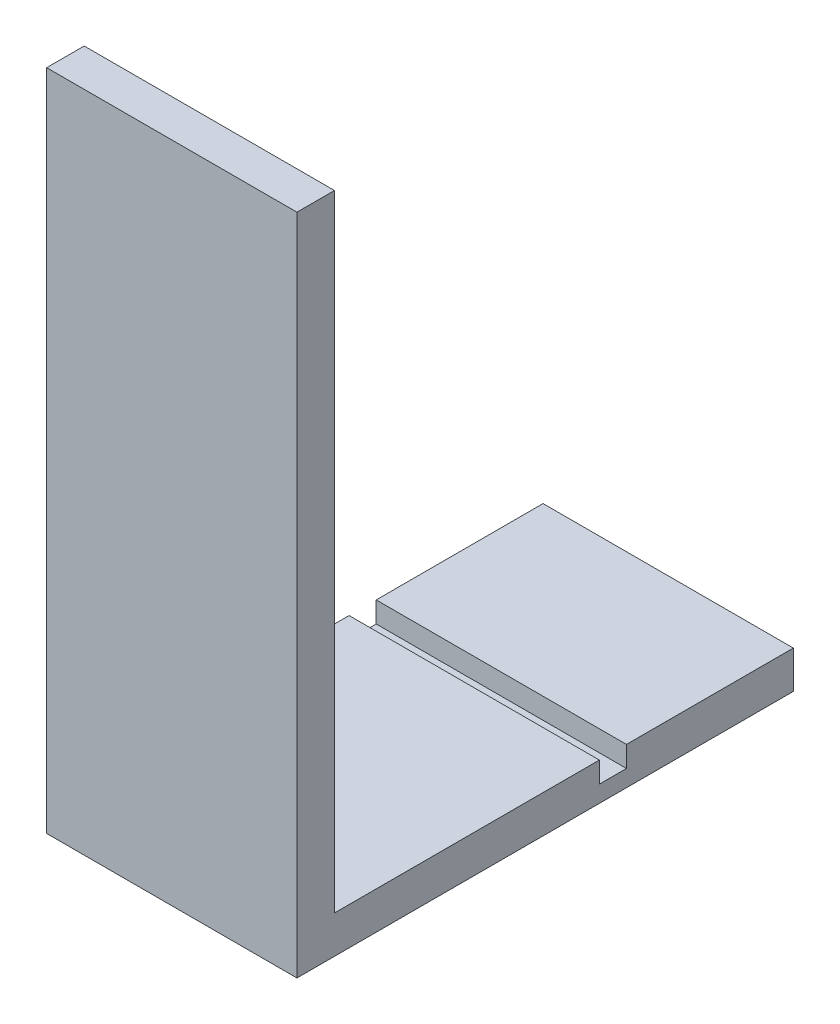
from build123d import *

# Parameters (mm, degrees)
EXTRUDE_1_DEPTH     = 120
SKETCH_2_W          = 13
SKETCH_2_H          = 10
CUT_EXTRUDE_1_DEPTH = 324.916484435


with BuildPart() as part:
    # 草圖1 → 填料-伸長1 (new body)
    with BuildSketch(Plane(origin=(0, 0, 0), x_dir=(0, 0, -1), z_dir=(1, 0, 0))):
        Polygon((-179.666666667, 241.333333333), (-179.666666667, -76.666666667), (58.333333333, -76.666666667), (58.333333333, -58.666666667), (-161.666666667, -58.666666667), (-161.666666667, 241.333333333), align=None)
    extrude(amount=EXTRUDE_1_DEPTH)

    # 草圖2 → 除料-伸長1 (cut, through all)
    with BuildSketch(Plane(origin=(120, 0, 0), x_dir=(0, 0, -1), z_dir=(1, 0, 0))):
        with Locations((-28.166666667, -63.666666667)):
            Rectangle(SKETCH_2_W, SKETCH_2_H)
    extrude(amount=-CUT_EXTRUDE_1_DEPTH, mode=Mode.SUBTRACT)


solid = part.part
